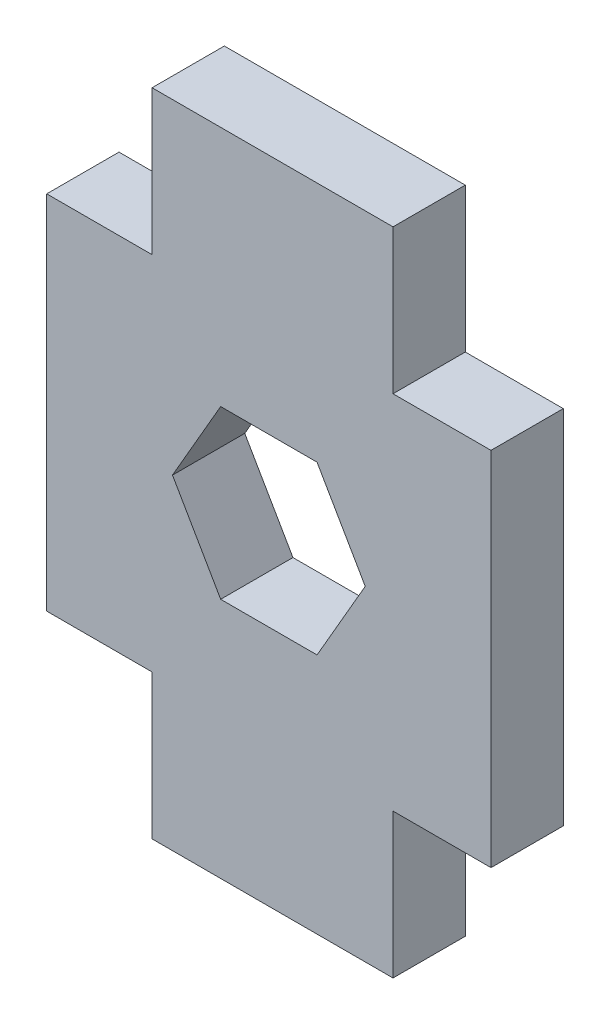
from build123d import *

# Parameters (mm, degrees)
BOSS_EXTRUDE1_DEPTH = 6


with BuildPart() as part:
    # Sketch1 → Boss-Extrude1 (new body)
    with BuildSketch(Plane.XY):
        Polygon((-211.428617248, -77.262954902), (-211.428617248, -107.262954902), (-202.683627049, -107.262954902), (-202.683627049, -113.262954902), (-202.683627049, -119.262954902), (-182.683627049, -119.262954902), (-182.683627049, -113.262954902), (-182.683627049, -107.262954902), (-174.549373808, -107.262954902), (-174.549373808, -77.262954902), (-182.683627049, -77.262954902), (-182.683627049, -71.262954902), (-182.683627049, -65.262954902), (-202.683627049, -65.262954902), (-202.683627049, -71.262954902), (-202.683627049, -77.262954902), align=None)
        Polygon((-184.988995528, -92.262954902), (-188.988995528, -85.334751672), (-196.988995528, -85.334751672), (-200.988995528, -92.262954902), (-196.988995528, -99.191158133), (-188.988995528, -99.191158133), align=None, mode=Mode.SUBTRACT)
    extrude(amount=BOSS_EXTRUDE1_DEPTH)


solid = part.part
